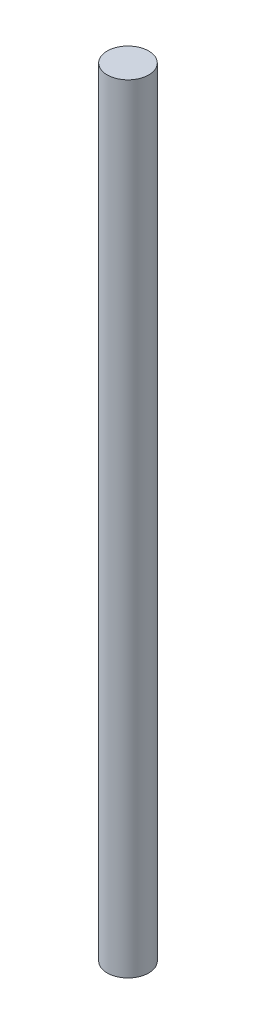
from build123d import *

# Parameters (mm, degrees)
SKETCH1_R           = 25.4
BOSS_EXTRUDE1_DEPTH = 952.5


with BuildPart() as part:
    # Sketch1 → Boss-Extrude1 (new body)
    with BuildSketch(Plane(origin=(0, 0, 0), x_dir=(1, 0, 0), z_dir=(0, 1, 0))):
        with Locations(Location((0, 0, 0), (0, 0, 270))):
            Circle(SKETCH1_R)
    extrude(amount=BOSS_EXTRUDE1_DEPTH)


solid = part.part
